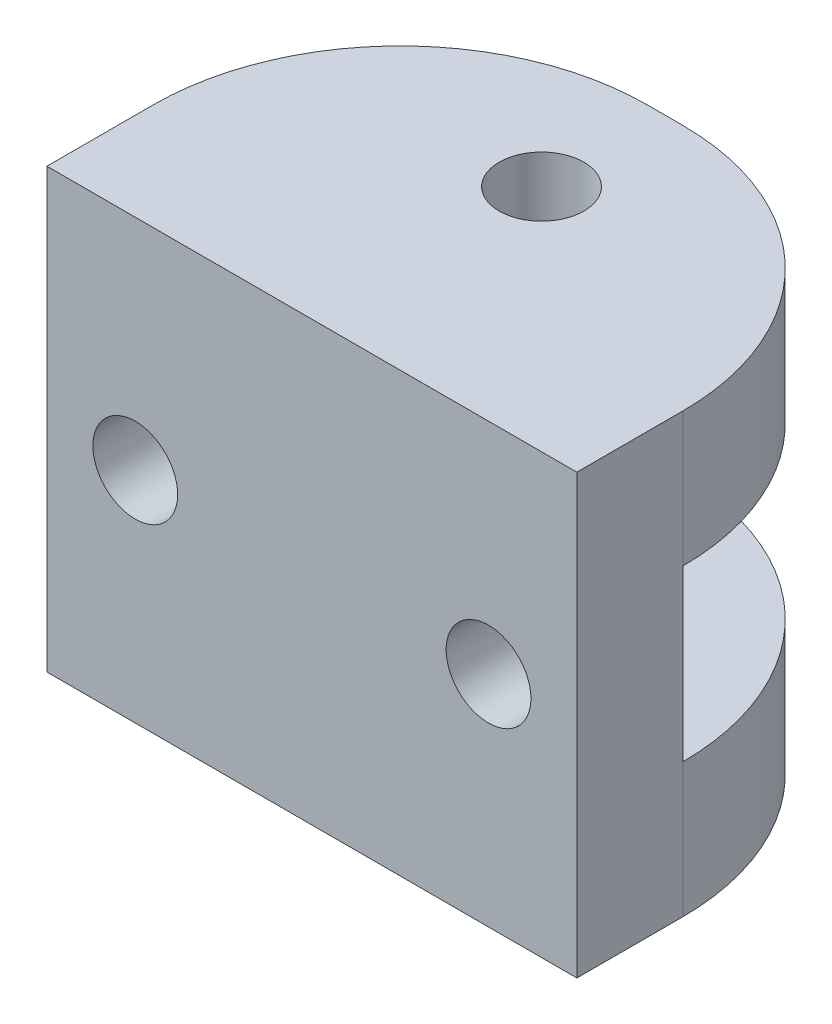
from build123d import *

# Parameters (mm, degrees)
BOSS_EXTRUDE1_DEPTH = 75
SKETCH2_R           = 6
CUT_EXTRUDE1_DEPTH  = 110.402925007
SKETCH3_R           = 6
CUT_EXTRUDE2_DEPTH  = 110.402925007
FILLET1_R           = 35


with BuildPart() as part:
    # Sketch1 → Boss-Extrude1 (new body)
    with BuildSketch(Plane(origin=(0, 0, 0), x_dir=(0, 0, -1), z_dir=(1, 0, 0))):
        Polygon((50, 62), (50, 43), (15, 43), (15, 19), (50, 19), (50, 0), (0, 0), (0, 62), align=None)
    extrude(amount=BOSS_EXTRUDE1_DEPTH)

    # Sketch2 → Cut-Extrude1 (cut, through all)
    with BuildSketch(Plane.XY):
        with Locations((62.5, 31)):
            Circle(SKETCH2_R)
        with Locations((12.5, 31)):
            Circle(SKETCH2_R)
    extrude(amount=-CUT_EXTRUDE1_DEPTH, mode=Mode.SUBTRACT)

    # Sketch3 → Cut-Extrude2 (cut, through all)
    with BuildSketch(Plane(origin=(0, 62, 0), x_dir=(1, 0, 0), z_dir=(0, 1, 0))):
        with Locations(Location((37.5, 32.5, 0), (0, 0, 270))):
            Circle(SKETCH3_R)
    extrude(amount=-CUT_EXTRUDE2_DEPTH, mode=Mode.SUBTRACT)

    # Fillet1
    fillet1_edges = [part.edges().sort_by_distance(p)[0] for p in [
        (75, 9.5, -50),
        (0, 9.5, -50),
        (0, 52.5, -50),
        (75, 52.5, -50),
    ]]
    fillet(fillet1_edges, radius=FILLET1_R)


solid = part.part
